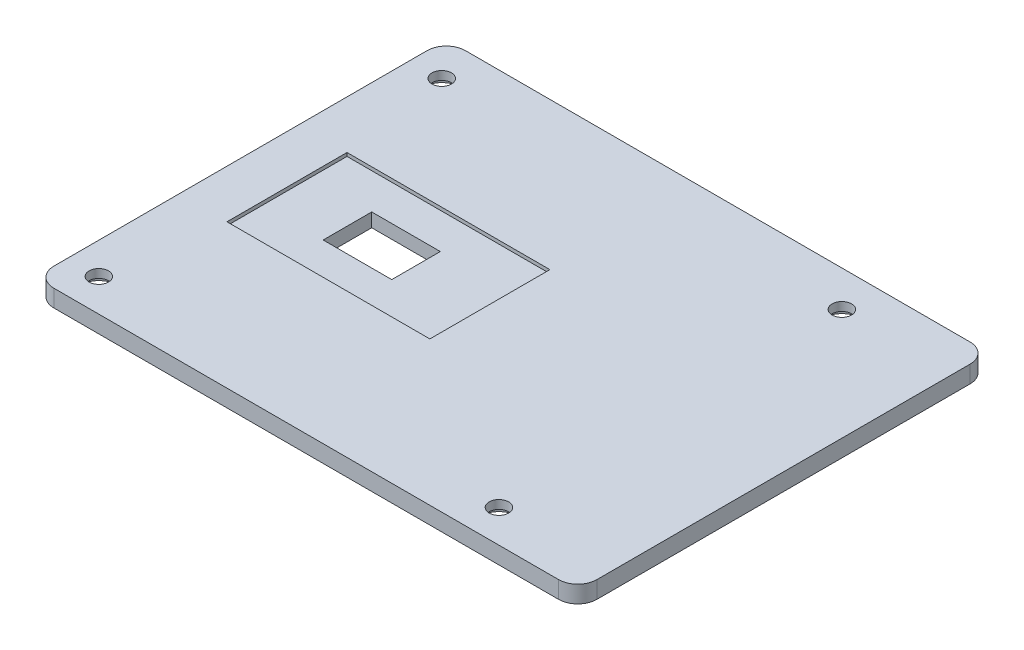
from build123d import *

# Parameters (mm, degrees)
EXTRUDE_2_DEPTH     = 3
SKETCH_11_R         = 1.7
CUT_EXTRUDE_2_DEPTH = 82.688432474
SKETCH_13_W         = 35.5
SKETCH_13_H         = 21
CUT_EXTRUDE_3_DEPTH = 0.6
SKETCH_14_W         = 12
SKETCH_14_H         = 8.5
CUT_EXTRUDE_4_DEPTH = 82.668598617
SKETCH_16_R         = 3.1
CUT_EXTRUDE_5_DEPTH = 1.5
SKETCH_17_R         = 3.35
CUT_EXTRUDE_6_DEPTH = 0.5


with BuildPart() as part:
    # 草图8 → 凸台-拉伸2 (new body)
    with BuildSketch(Plane(origin=(0, 0, 0), x_dir=(1, 0, 0), z_dir=(0, 1, 0))):
        with BuildLine():
            Line((-21.65, 30), (66.65, 30))
            ThreePointArc((66.65, 30), (69.018807717, 29.018807717), (70, 26.65))
            Line((70, 26.65), (70, -38.65))
            ThreePointArc((70, -38.65), (69.018807717, -41.018807717), (66.65, -42))
            Line((66.65, -42), (-21.65, -42))
            ThreePointArc((-21.65, -42), (-24.018807717, -41.018807717), (-25, -38.65))
            Line((-25, -38.65), (-25, 26.65))
            ThreePointArc((-25, 26.65), (-24.018807717, 29.018807717), (-21.65, 30))
        make_face()
    extrude(amount=EXTRUDE_2_DEPTH)

    # 草图11 → 切除-拉伸2 (cut, through all)
    with BuildSketch(Plane(origin=(0, 3, 0), x_dir=(1, 0, 0), z_dir=(0, 1, 0))):
        with Locations(Location((-19.5, 23.71, 0), (0, 0, 270))):
            Circle(SKETCH_11_R)
        with Locations(Location((-19.5, -36.29, 0), (0, 0, 270))):
            Circle(SKETCH_11_R)
        with Locations(Location((50.5, 23.71, 0), (0, 0, 270))):
            Circle(SKETCH_11_R)
        with Locations(Location((50.5, -36.29, 0), (0, 0, 270))):
            Circle(SKETCH_11_R)
    extrude(amount=-CUT_EXTRUDE_2_DEPTH, mode=Mode.SUBTRACT)

    # 草图13 → 切除-拉伸3 (cut)
    with BuildSketch(Plane(origin=(0, 3, 0), x_dir=(1, 0, 0), z_dir=(0, 1, 0))):
        with Locations((1.176, -6.295)):
            Rectangle(SKETCH_13_W, SKETCH_13_H)
    extrude(amount=-CUT_EXTRUDE_3_DEPTH, mode=Mode.SUBTRACT)

    # 草图14 → 切除-拉伸4 (cut, through all)
    with BuildSketch(Plane(origin=(0, 2.4, 0), x_dir=(1, 0, 0), z_dir=(0, 1, 0))):
        with Locations((0, -6.29)):
            Rectangle(SKETCH_14_W, SKETCH_14_H)
    extrude(amount=-CUT_EXTRUDE_4_DEPTH, mode=Mode.SUBTRACT)

    # 草图16 → 切除-拉伸5 (cut)
    with BuildSketch(Plane.XZ):
        with Locations(Location((-19.5, 36.29, 0), (0, 0, 270))):
            Circle(SKETCH_16_R)
        with Locations(Location((-19.5, -23.71, 0), (0, 0, 270))):
            Circle(SKETCH_16_R)
        with Locations(Location((50.5, 36.29, 0), (0, 0, 270))):
            Circle(SKETCH_16_R)
        with Locations(Location((50.5, -23.71, 0), (0, 0, 270))):
            Circle(SKETCH_16_R)
    extrude(amount=-CUT_EXTRUDE_5_DEPTH, mode=Mode.SUBTRACT)

    # 草图17 → 切除-拉伸6 (cut)
    with BuildSketch(Plane.XZ):
        with Locations(Location((-19.5, 36.29, 0), (0, 0, 270))):
            Circle(SKETCH_17_R)
        with Locations(Location((-19.5, -23.71, 0), (0, 0, 270))):
            Circle(SKETCH_17_R)
        with Locations(Location((50.5, 36.29, 0), (0, 0, 270))):
            Circle(SKETCH_17_R)
        with Locations(Location((50.5, -23.71, 0), (0, 0, 270))):
            Circle(SKETCH_17_R)
    extrude(amount=-CUT_EXTRUDE_6_DEPTH, mode=Mode.SUBTRACT)


solid = part.part
